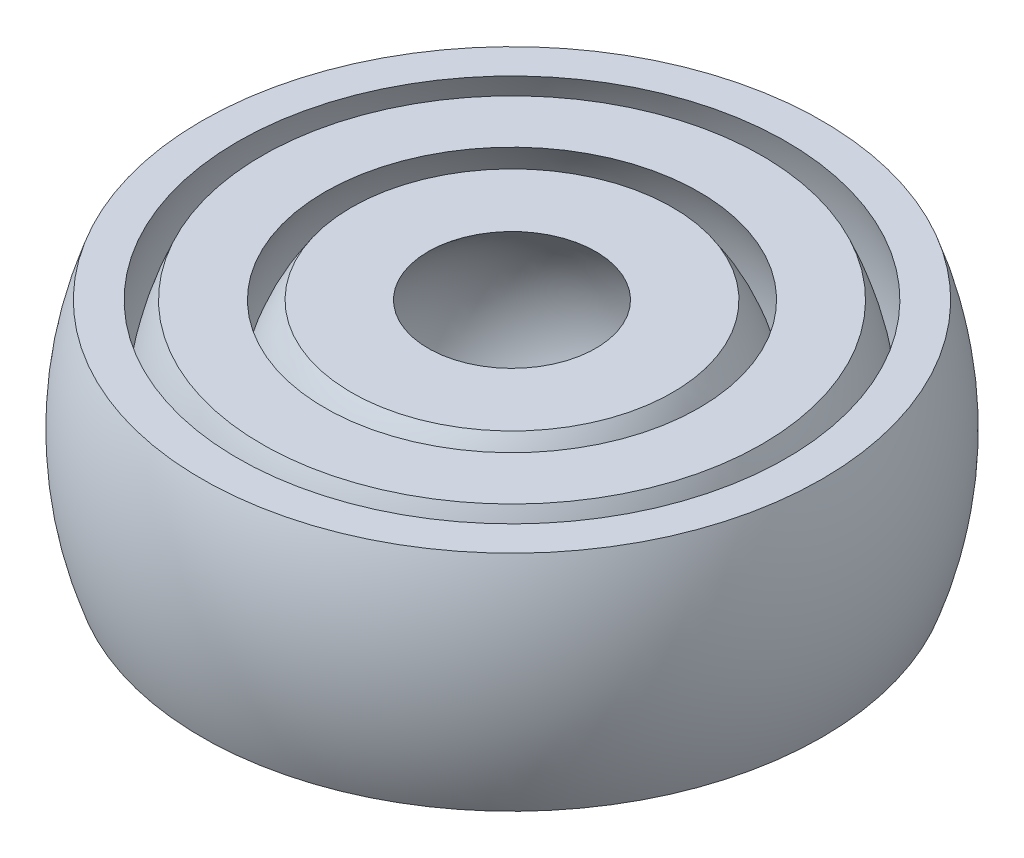
from build123d import *


with BuildPart() as part:
    # Croquis1 → Revolución1 (revolve)
    with BuildSketch(Plane.XY):
        with BuildLine():
            Line((-3, 4), (-5.744562647, 4))
            ThreePointArc((-5.744562647, 4), (-7, 0), (-5.744562647, -4))
            Line((-5.744562647, -4), (-3, -4))
            ThreePointArc((-3, -4), (-5, 0), (-3, 4))
        make_face()
    revolve(axis=Axis((0, 12.754949066, 0), (0, -1, 0)))


with BuildPart() as body_2:
    # Croquis3 → Revolución2 (revolve)
    with BuildSketch(Plane.XY):
        with BuildLine():
            ThreePointArc((6.696267617, -4), (7.8, 0), (6.696267617, 4))
            Line((6.696267617, 4), (8.946507699, 4))
            ThreePointArc((8.946507699, 4), (9.8, 0), (8.946507699, -4))
            Line((8.946507699, -4), (6.696267617, -4))
        make_face()
    revolve(axis=Axis((0, 4.223618172, 0), (0, -1, 0)))


with BuildPart() as body_3:
    # Croquis4 → Revolución3 (revolve)
    with BuildSketch(Plane.XY):
        with BuildLine():
            Line((-9.816312953, 4), (-11.101351269, 4))
            ThreePointArc((-11.101351269, 4), (-11.8, 0), (-11.101351269, -4))
            Line((-11.101351269, -4), (-9.816312953, -4))
            ThreePointArc((-9.816312953, -4), (-10.6, 0), (-9.816312953, 4))
        make_face()
    revolve(axis=Axis((0, 4.326530612, 0), (0, -1, 0)))


solid = Compound([part.part, body_2.part, body_3.part])
